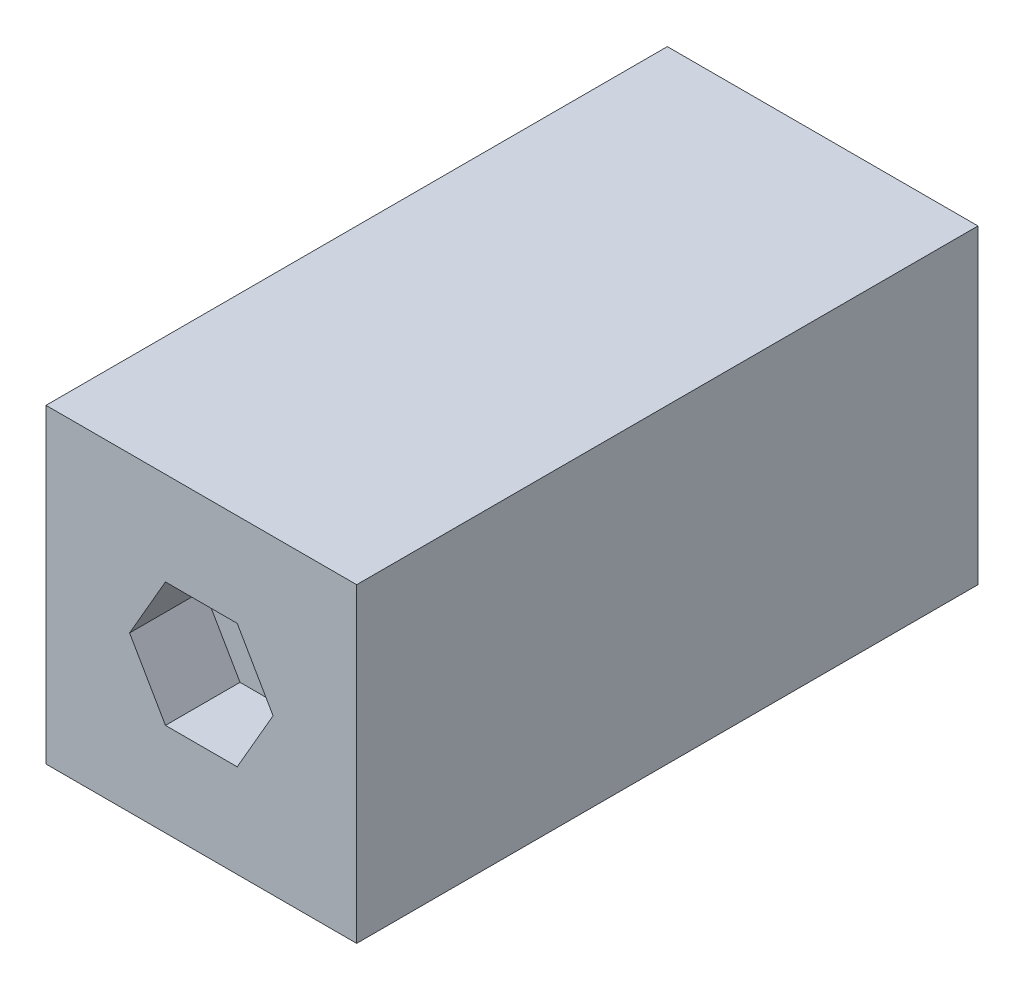
from build123d import *

# Parameters (mm, degrees)
CROQUIS1_W              = 25
CROQUIS1_H              = 25
SALIENTE_EXTRUIR1_DEPTH = 50
CORTAR_EXTRUIR1_DEPTH   = 6


with BuildPart() as part:
    # Croquis1 → Saliente-Extruir1 (new body)
    with BuildSketch(Plane.XY):
        with Locations((12.5, 12.5)):
            Rectangle(CROQUIS1_W, CROQUIS1_H)
    extrude(amount=SALIENTE_EXTRUIR1_DEPTH)

    # Croquis2 → Cortar-Extruir1 (cut)
    with BuildSketch(Plane.XY.offset(50)):
        Polygon((18.273502692, 12.5), (15.386751346, 17.5), (9.613248654, 17.5), (6.726497308, 12.5), (9.613248654, 7.5), (15.386751346, 7.5), align=None)
    extrude(amount=-CORTAR_EXTRUIR1_DEPTH, mode=Mode.SUBTRACT)


solid = part.part
